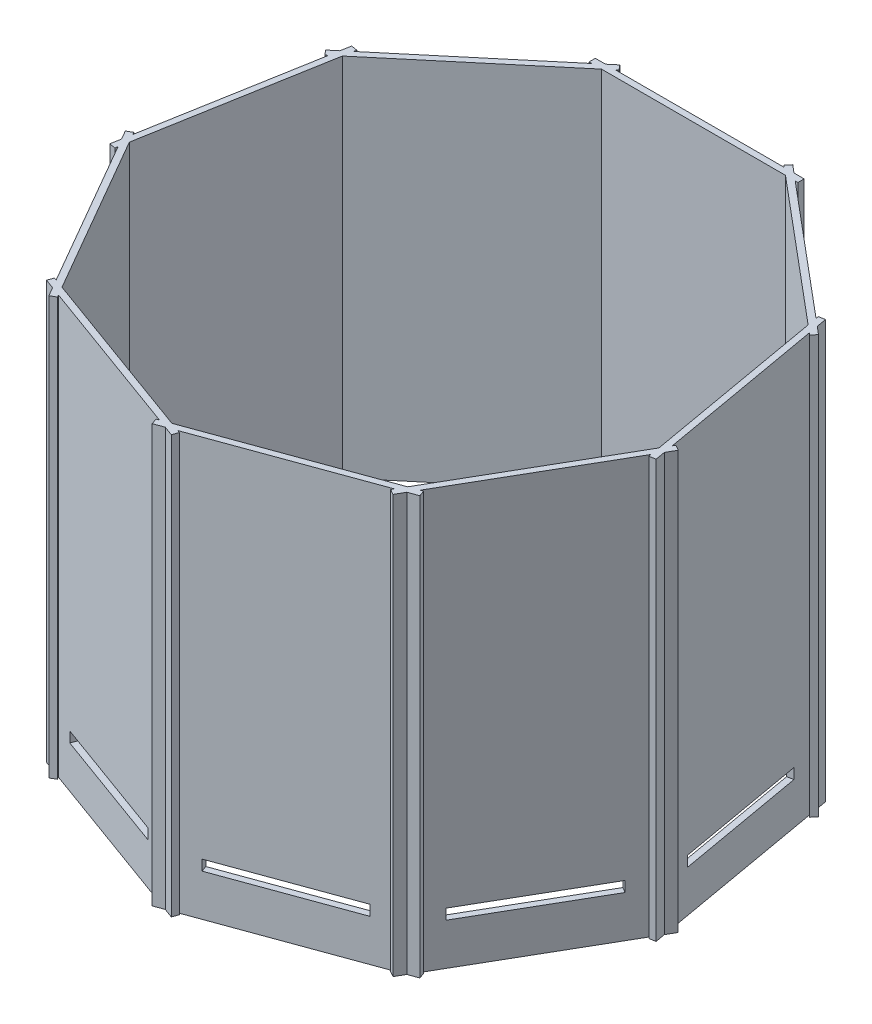
from build123d import *

# Parameters (mm, degrees)
SKETCH_3_W               = 100
SKETCH_3_H               = 3
EXTRUDE_2_DEPTH          = 200
SKETCH_4_R               = 125
CUT_EXTRUDE_3_DEPTH      = 5
SKETCH_5_W               = 62.737548566
SKETCH_5_H               = 5
CUT_EXTRUDE_4_DEPTH      = 207.177108332
PATTERN_CIRCULAR_1_COUNT = 9


with BuildPart() as part:
    # 草圖3 → 填料-伸長2 (new body)
    with BuildSketch(Plane(origin=(0, 0, 0), x_dir=(1, 0, 0), z_dir=(0, 1, 0))):
        with Locations((0, 122.5)):
            Rectangle(SKETCH_3_W, SKETCH_3_H)
    extrude_2 = extrude(amount=-EXTRUDE_2_DEPTH)

    # 草圖4 → 除料-伸長3 (cut)
    with BuildSketch(Plane(origin=(0, -180, 0), x_dir=(-1, 0, 0), z_dir=(0, -1, 0))):
        Circle(SKETCH_4_R)
    extrude(amount=-CUT_EXTRUDE_3_DEPTH, mode=Mode.SUBTRACT)

    # 草圖5 → 除料-伸長4 (cut, through all)
    with BuildSketch(Plane.XY.offset(-121)):
        with Locations((0, -177.5)):
            Rectangle(SKETCH_5_W, SKETCH_5_H)
    cut_extrude_4 = extrude(amount=-CUT_EXTRUDE_4_DEPTH, mode=Mode.SUBTRACT)

    # 環狀複製排列1: 填料-伸長2, 除料-伸長4 ×9 about axis
    pattern_circular_1_axis = Axis((0, 0, 0), (0, 1, 0))
    add([extrude_2.rotate(pattern_circular_1_axis, i * 360 / PATTERN_CIRCULAR_1_COUNT) for i in range(1, PATTERN_CIRCULAR_1_COUNT)])
    add([cut_extrude_4.rotate(pattern_circular_1_axis, i * 360 / PATTERN_CIRCULAR_1_COUNT) for i in range(1, PATTERN_CIRCULAR_1_COUNT)], mode=Mode.SUBTRACT)


solid = part.part
